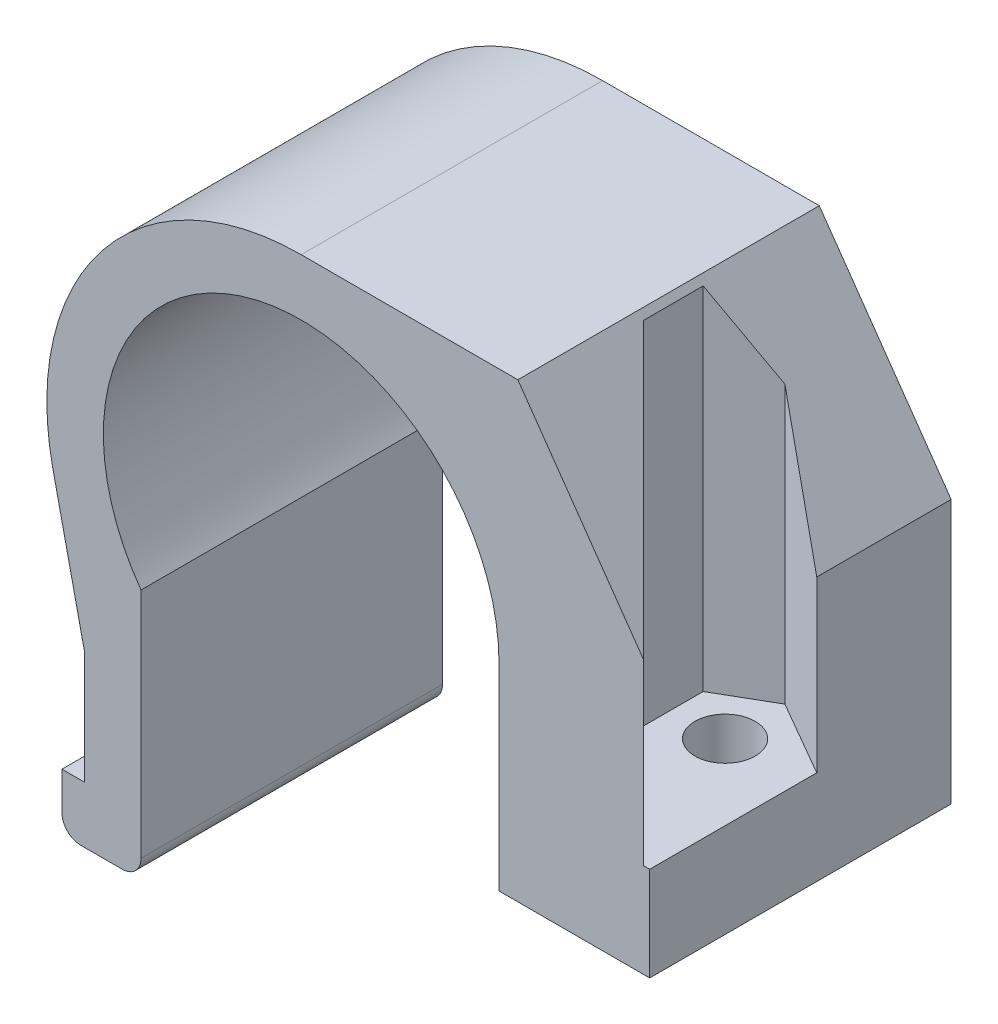
from build123d import *

# Parameters (mm, degrees)
BOSS_EXTRUDE1_DEPTH = 16
CHAMFER1_SIZE       = 10
CHAMFER1_SIZE2      = 7
SKETCH2_R           = 1.6
CUT_EXTRUDE1_DEPTH  = 35.267331381
CUT_EXTRUDE2_START  = -5
CUT_EXTRUDE2_DEPTH  = 30.267331381
FILLET1_R           = 1


with BuildPart() as part:
    # Sketch1 → Boss-Extrude1 (new body)
    with BuildSketch(Plane.XY):
        with BuildLine():
            Line((10.5, 0), (10.5, -10.5))
            Line((10.5, -10.5), (18.5, -10.5))
            Line((18.5, -10.5), (18.5, 13.5))
            Line((18.5, 13.5), (0, 13.5))
            ThreePointArc((0, 13.5), (-10.52842962, 8.449980458), (-13.180003635, -2.92190078))
            Line((-13.180003635, -2.92190078), (-11.5, -10.5))
            Line((-11.5, -10.5), (-11.5, -16.5))
            Line((-11.5, -16.5), (-12.697755895, -16.5))
            Line((-12.697755895, -16.5), (-12.697755895, -18.5))
            ThreePointArc((-12.697755895, -18.5), (-12.404862676, -19.207106781), (-11.697755895, -19.5))
            Line((-11.697755895, -19.5), (-8.5, -19.5))
            Line((-8.5, -19.5), (-8.5, -6.164414003))
            ThreePointArc((-8.5, -6.164414003), (-3.240370349, 9.987492178), (10.5, 0))
        make_face()
    extrude(amount=BOSS_EXTRUDE1_DEPTH)

    # Chamfer1
    chamfer1_edges = [part.edges().sort_by_distance(p)[0] for p in [
        (18.5, 13.5, 8),
    ]]
    chamfer1_side = [part.faces().sort_by_distance(p)[0] for p in [
        (18.5, 1.5, 8),
    ]]
    chamfer(chamfer1_edges, length=CHAMFER1_SIZE, length2=CHAMFER1_SIZE2, reference=chamfer1_side[0])

    # Sketch2 → Cut-Extrude1 (cut, through all)
    with BuildSketch(Plane.XZ.offset(10.5)):
        with Locations(Location((14.5, 8, 0), (0, 0, 270))):
            Circle(SKETCH2_R)
    extrude(amount=-CUT_EXTRUDE1_DEPTH, mode=Mode.SUBTRACT)

    # Sketch3 → Cut-Extrude2 (cut, through all)
    with BuildSketch(Plane.XZ.offset(10.5).offset(CUT_EXTRUDE2_START)):
        Polygon((17.25, 6.41228676), (19.609136336, 7.774334758), (19.609136336, 17.446849576), (11.75, 9.58771324), (11.75, 6.41228676), (14.5, 4.824573519), align=None)
    extrude(amount=-CUT_EXTRUDE2_DEPTH, mode=Mode.SUBTRACT)

    # Fillet1
    fillet1_edges = [part.edges().sort_by_distance(p)[0] for p in [
        (-8.5, -19.5, 8),
    ]]
    fillet(fillet1_edges, radius=FILLET1_R)


solid = part.part
